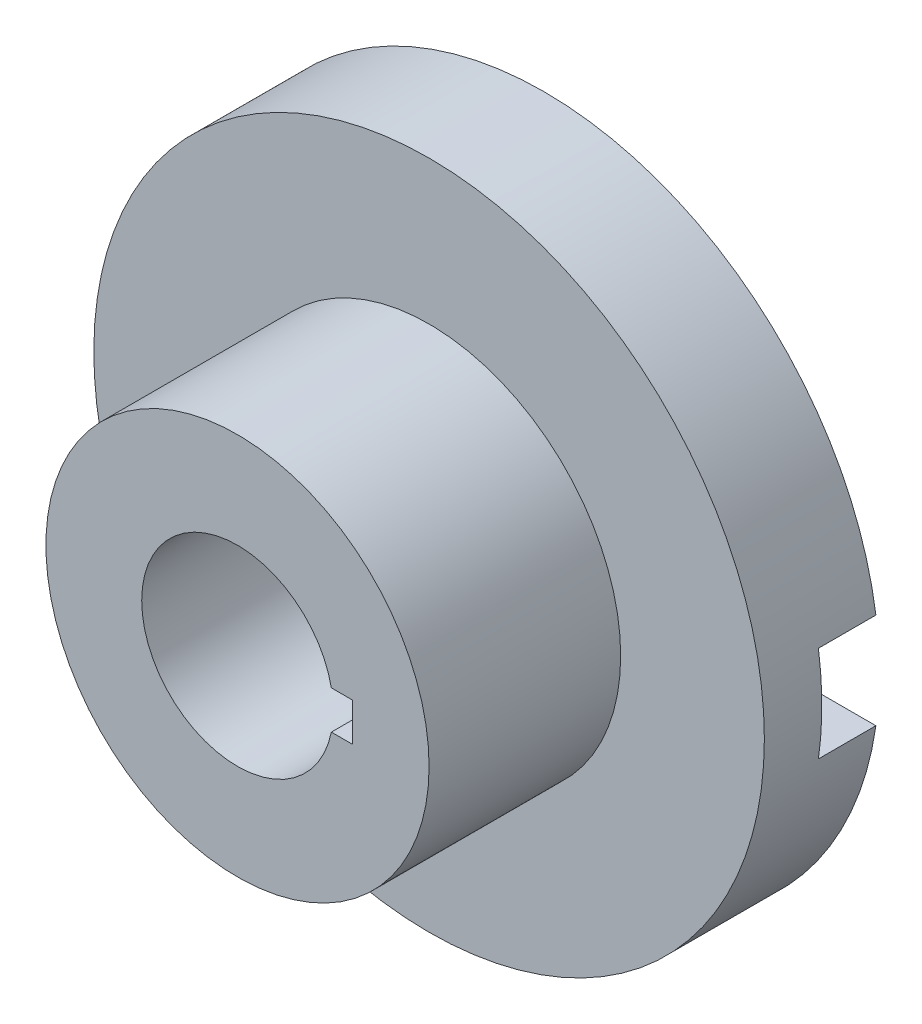
from build123d import *

# Parameters (mm, degrees)
SKETCH1_R           = 175
BOSS_EXTRUDE1_DEPTH = 60
SKETCH2_R           = 100
BOSS_EXTRUDE2_DEPTH = 100
CUT_EXTRUDE1_DEPTH  = 30
CUT_EXTRUDE2_DEPTH  = 295.703240566


with BuildPart() as part:
    # Sketch1 → Boss-Extrude1 (new body)
    with BuildSketch(Plane.XY):
        Circle(SKETCH1_R)
    extrude(amount=BOSS_EXTRUDE1_DEPTH)

    # Sketch2 → Boss-Extrude2 (add)
    with BuildSketch(Plane.XY.offset(60)):
        Circle(SKETCH2_R)
    extrude(amount=BOSS_EXTRUDE2_DEPTH)

    # Sketch4 → Cut-Extrude1 (cut)
    with BuildSketch(Plane.XY):
        with BuildLine():
            Line((173.205080757, 25), (-173.205080757, 25))
            ThreePointArc((-173.205080757, 25), (-175, 0), (-173.205080757, -25))
            Line((-173.205080757, -25), (173.205080757, -25))
            ThreePointArc((173.205080757, -25), (175, 0), (173.205080757, 25))
        make_face()
    extrude(amount=CUT_EXTRUDE1_DEPTH, mode=Mode.SUBTRACT)

    # Sketch6 → Cut-Extrude2 (cut, through all)
    with BuildSketch(Plane.XY.offset(160)):
        with BuildLine():
            Line((59.999794856, 10), (59.999794856, -10))
            Line((59.999794856, -10), (48.989794856, -10))
            ThreePointArc((48.989794856, -10), (-50, 0), (48.989794856, 10))
            Line((48.989794856, 10), (59.999794856, 10))
        make_face()
    extrude(amount=-CUT_EXTRUDE2_DEPTH, mode=Mode.SUBTRACT)


solid = part.part
